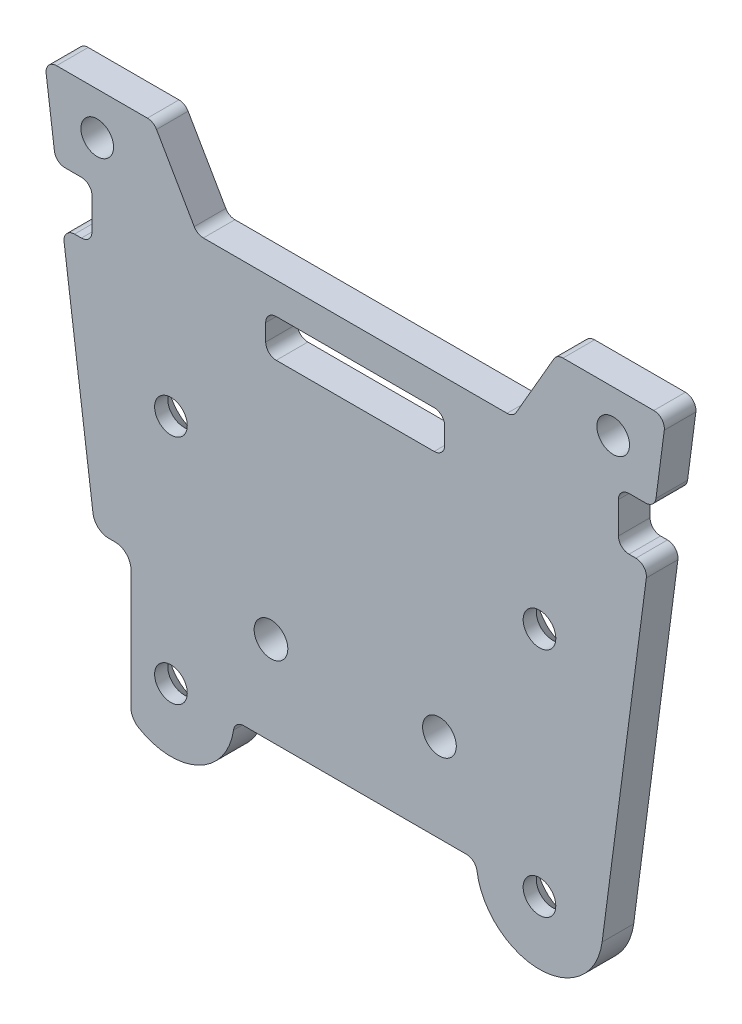
from build123d import *

# Parameters (mm, degrees)
SKETCH_1_R               = 1.55
SKETCH_1_R_2             = 1.6
SKETCH_1_W               = 17
SKETCH_1_H               = 3.6
EXTRUDE_1_DEPTH          = 3
HOLE_WIZARD_1_AT_2_COUNT = 2
HOLE_WIZARD_1_AT_2_PITCH = 41.340053217
HOLE_WIZARD_1_AT_3_COUNT = 2
HOLE_WIZARD_1_AT_3_PITCH = 22
HOLE_WIZARD_1_AT_4_COUNT = 2
HOLE_WIZARD_1_AT_4_PITCH = 35
SKETCH_3_W               = 9
SKETCH_3_H               = 5
CUT_EXTRUDE_1_DEPTH      = 10
FILLET_1_R               = 1
SKETCH_4_W               = 16.565491158
SKETCH_4_H               = 15
CUT_EXTRUDE_2_DEPTH      = 10
FILLET_2_R               = 1.5


with BuildPart() as part:
    # 草图1 → 凸台-拉伸1 (new body)
    with BuildSketch(Plane.XY):
        with BuildLine():
            Line((29.5, 20.5), (19.156921938, 20.5))
            Line((19.156921938, 20.5), (15, 13.3))
            Line((15, 13.3), (-15, 13.3))
            Line((-15, 13.3), (-19.156921938, 20.5))
            Line((-19.156921938, 20.5), (-29.5, 20.5))
            Line((-29.5, 20.5), (-23.44914812, -25.679510516))
            ThreePointArc((-23.44914812, -25.679510516), (-17.109416283, -30.887273533), (-11.5, -24.9))
            Line((-11.5, -24.9), (11.5, -24.9))
            ThreePointArc((11.5, -24.9), (17.109416283, -30.887273533), (23.44914812, -25.679510516))
            Line((23.44914812, -25.679510516), (29.5, 20.5))
        make_face()
        with Locations((-24.5, 16.5)):
            Circle(SKETCH_1_R, mode=Mode.SUBTRACT)
        with Locations((-8, -16.5)):
            Circle(SKETCH_1_R_2, mode=Mode.SUBTRACT)
        with Locations(Location((8, -16.5, 0), (0, 0, 180))):
            Circle(SKETCH_1_R_2, mode=Mode.SUBTRACT)
        with Locations(Location((24.5, 16.5, 0), (0, 0, 180))):
            Circle(SKETCH_1_R, mode=Mode.SUBTRACT)
        with Locations((-17.5, -24.9)):
            Circle(SKETCH_1_R, mode=Mode.SUBTRACT)
        with Locations((17.5, -24.9)):
            Circle(SKETCH_1_R, mode=Mode.SUBTRACT)
        with Locations((-17.5, -2.9)):
            Circle(SKETCH_1_R, mode=Mode.SUBTRACT)
        with Locations(Location((17.5, -2.9, 0), (0, 0, 180))):
            Circle(SKETCH_1_R, mode=Mode.SUBTRACT)
        with Locations((0, 8.5)):
            Rectangle(SKETCH_1_W, SKETCH_1_H, mode=Mode.SUBTRACT)
    extrude(amount=EXTRUDE_1_DEPTH)

    # 草图2 → 打孔尺寸(%根据十字)槽沉头木螺钉的类型1 (revolve, cut)
    with BuildSketch(Plane(origin=(-17.5, -24.9, 0), x_dir=(0, 1, 0), z_dir=(1, 0, 0))):
        Polygon((0, 0), (0, 3), (1.55, 3), (1.55, 1.75), (3.3, 0), align=None)
    hole_wizard_1 = revolve(axis=Axis((-17.5, -24.9, -6.35), (0, 0, 1)), mode=Mode.SUBTRACT)

    # 打孔尺寸(%根据十字)槽沉头木螺钉的类型1 at 2: 打孔尺寸(%根据十字)槽沉头木螺钉的类型1 ×2
    with Locations(*[Vector(0.846636549211005, 0.5321715452183458, 0) * (i * HOLE_WIZARD_1_AT_2_PITCH) for i in range(1, HOLE_WIZARD_1_AT_2_COUNT)]):
        add(hole_wizard_1, mode=Mode.SUBTRACT)

    # 打孔尺寸(%根据十字)槽沉头木螺钉的类型1 at 3: 打孔尺寸(%根据十字)槽沉头木螺钉的类型1 ×2
    with Locations(*[(0, i * HOLE_WIZARD_1_AT_3_PITCH, 0) for i in range(1, HOLE_WIZARD_1_AT_3_COUNT)]):
        add(hole_wizard_1, mode=Mode.SUBTRACT)

    # 打孔尺寸(%根据十字)槽沉头木螺钉的类型1 at 4: 打孔尺寸(%根据十字)槽沉头木螺钉的类型1 ×2
    with Locations(*[(i * HOLE_WIZARD_1_AT_4_PITCH, 0, 0) for i in range(1, HOLE_WIZARD_1_AT_4_COUNT)]):
        add(hole_wizard_1, mode=Mode.SUBTRACT)

    # 草图3 → 切除-拉伸1 (cut)
    with BuildSketch(Plane.XY.offset(3)):
        with Locations((29.5, 10)):
            Rectangle(SKETCH_3_W, SKETCH_3_H)
        with Locations((-29.5, 10)):
            Rectangle(SKETCH_3_W, SKETCH_3_H)
    extrude(amount=-CUT_EXTRUDE_1_DEPTH, mode=Mode.SUBTRACT)

    # 圆角1
    fillet_1_edges = [part.edges().sort_by_distance(p)[0] for p in [
        (28.451768555, 12.5, 1.5),
        (27.796623902, 7.5, 1.5),
        (-28.451768555, 12.5, 1.5),
        (-27.796623902, 7.5, 1.5),
        (25, 7.5, 1.5),
        (25, 12.5, 1.5),
        (-25, 12.5, 1.5),
        (-25, 7.5, 1.5),
        (-19.156921938, 20.5, 1.5),
        (-15, 13.3, 1.5),
        (15, 13.3, 1.5),
        (19.156921938, 20.5, 1.5),
        (29.5, 20.5, 1.5),
        (11.5, -24.9, 1.5),
        (-11.5, -24.9, 1.5),
        (-29.5, 20.5, 1.5),
        (8.5, 6.7, 1.5),
        (8.5, 10.3, 1.5),
        (-8.5, 10.3, 1.5),
        (-8.5, 6.7, 1.5),
    ]]
    fillet(fillet_1_edges, radius=FILLET_1_R)

    # 草图4 → 切除-拉伸2 (cut)
    with BuildSketch(Plane(origin=(0, 0, 0), x_dir=(-1, 0, 0), z_dir=(0, 0, -1))):
        with Locations((29.582745579, -23.4)):
            Rectangle(SKETCH_4_W, SKETCH_4_H)
    extrude(amount=-CUT_EXTRUDE_2_DEPTH, mode=Mode.SUBTRACT)

    # 圆角2
    fillet_2_edges = [part.edges().sort_by_distance(p)[0] for p in [
        (-21.3, -29.543274706, 1.5),
        (-24.730546925, -15.9, 1.5),
        (-21.3, -15.9, 1.5),
    ]]
    fillet(fillet_2_edges, radius=FILLET_2_R)


solid = part.part
